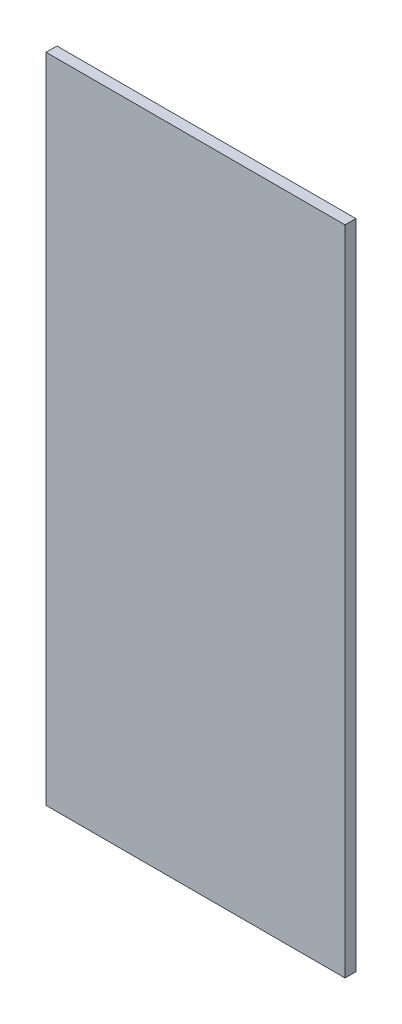
from build123d import *

# Parameters (mm, degrees)
SZKIC1_W                    = 55
SZKIC1_H                    = 120
DODANIE_WYCI_GNI_CIE1_DEPTH = 2


with BuildPart() as part:
    # Szkic1 → Dodanie-wyciągnięcie1 (new body)
    with BuildSketch(Plane.XY):
        with Locations((4.062627815, -38.171388338)):
            Rectangle(SZKIC1_W, SZKIC1_H)
    extrude(amount=DODANIE_WYCI_GNI_CIE1_DEPTH)


solid = part.part
